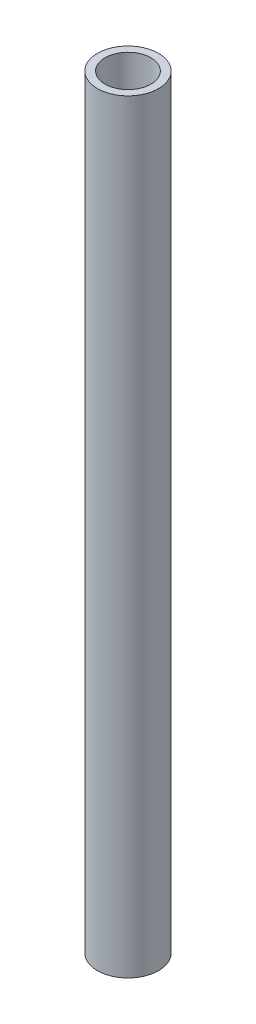
from build123d import *

# Parameters (mm, degrees)
SKETCH_1_R      = 4
SKETCH_1_R_2    = 3
EXTRUDE_1_DEPTH = 100


with BuildPart() as part:
    # 草图1 → 凸台-拉伸1 (new body)
    with BuildSketch(Plane(origin=(0, 0, 0), x_dir=(1, 0, 0), z_dir=(0, 1, 0))):
        with Locations(Location((0, 0, 0), (0, 0, 270))):
            Circle(SKETCH_1_R)
        with Locations(Location((0, 0, 0), (0, 0, 270))):
            Circle(SKETCH_1_R_2, mode=Mode.SUBTRACT)
    extrude(amount=EXTRUDE_1_DEPTH)


solid = part.part
